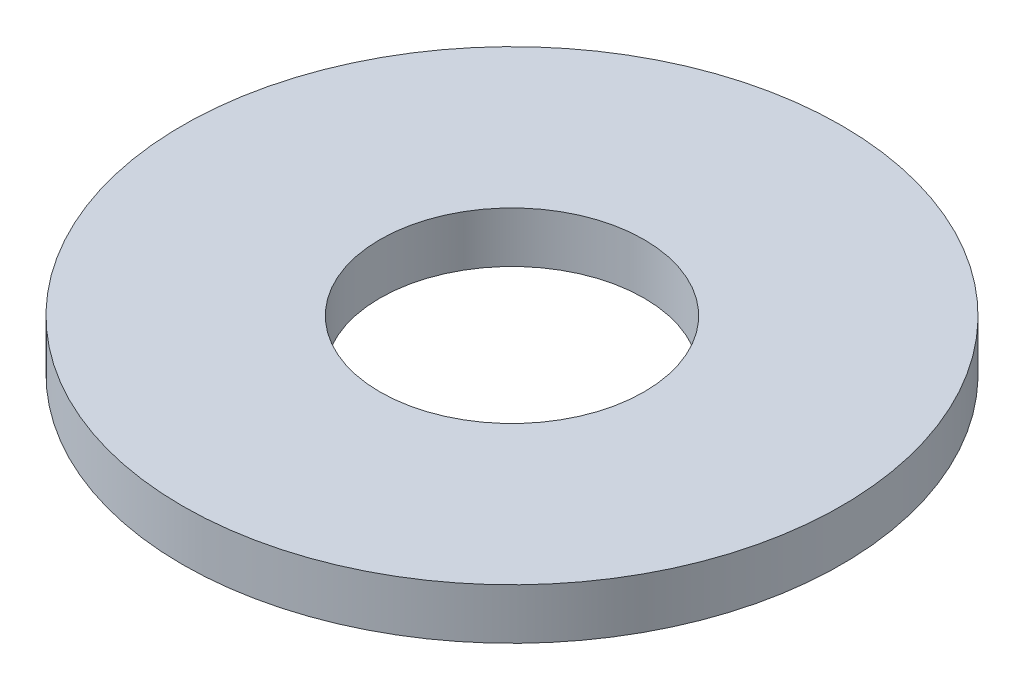
from build123d import *

# Parameters (mm, degrees)
SKETCH1_R           = 3.9624
SKETCH1_R_2         = 1.5875
BOSS_EXTRUDE1_DEPTH = 0.6096


with BuildPart() as part:
    # Sketch1 → Boss-Extrude1 (new body)
    with BuildSketch(Plane(origin=(0, 0, 0), x_dir=(1, 0, 0), z_dir=(0, 1, 0))):
        with Locations(Location((0, 0, 0), (0, 0, 270))):
            Circle(SKETCH1_R)
        with Locations(Location((0, 0, 0), (0, 0, 270))):
            Circle(SKETCH1_R_2, mode=Mode.SUBTRACT)
    extrude(amount=BOSS_EXTRUDE1_DEPTH)


solid = part.part
